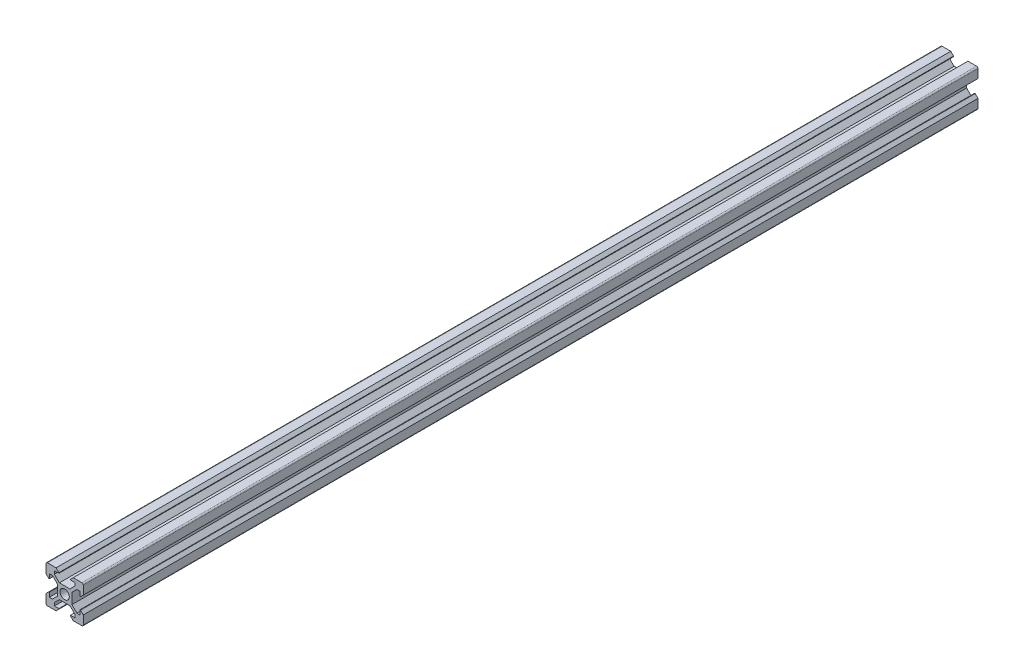
from build123d import *

# Parameters (mm, degrees)
CROQUIS1_R              = 2.5
SALIENTE_EXTRUIR1_DEPTH = 480


with BuildPart() as part:
    # Croquis1 → Saliente-Extruir1 (new body)
    with BuildSketch(Plane.XY):
        with BuildLine():
            Line((-4.6, 10), (-3.1, 8.5))
            Line((-3.1, 8.5), (-3.1, 8.2))
            Line((-3.1, 8.2), (-5.5, 8.2))
            Line((-5.5, 8.2), (-5.5, 6.560660172))
            Line((-5.5, 6.560660172), (-2.84, 3.900660172))
            Line((-2.84, 3.900660172), (0, 3.900660172))
            Line((0, 3.900660172), (2.84, 3.900660172))
            Line((2.84, 3.900660172), (5.5, 6.560660172))
            Line((5.5, 6.560660172), (5.5, 8.2))
            Line((5.5, 8.2), (3.1, 8.2))
            Line((3.1, 8.2), (3.1, 8.5))
            Line((3.1, 8.5), (4.6, 10))
            Line((4.6, 10), (9.25, 10))
            ThreePointArc((9.25, 10), (9.780330086, 9.780330086), (10, 9.25))
            Line((10, 9.25), (10, 4.6))
            Line((10, 4.6), (8.5, 3.1))
            Line((8.5, 3.1), (8.2, 3.1))
            Line((8.2, 3.1), (8.2, 5.5))
            Line((8.2, 5.5), (6.560660172, 5.5))
            Line((6.560660172, 5.5), (3.900660172, 2.84))
            Line((3.900660172, 2.84), (3.900660172, 0))
            Line((3.900660172, 0), (3.900660172, -2.84))
            Line((3.900660172, -2.84), (6.560660172, -5.5))
            Line((6.560660172, -5.5), (8.2, -5.5))
            Line((8.2, -5.5), (8.2, -3.1))
            Line((8.2, -3.1), (8.5, -3.1))
            Line((8.5, -3.1), (10, -4.6))
            Line((10, -4.6), (10, -9.25))
            ThreePointArc((10, -9.25), (9.780330086, -9.780330086), (9.25, -10))
            Line((9.25, -10), (4.6, -10))
            Line((4.6, -10), (3.1, -8.5))
            Line((3.1, -8.5), (3.1, -8.2))
            Line((3.1, -8.2), (5.5, -8.2))
            Line((5.5, -8.2), (5.5, -6.560660172))
            Line((5.5, -6.560660172), (2.84, -3.900660172))
            Line((2.84, -3.900660172), (0, -3.900660172))
            Line((0, -3.900660172), (-2.84, -3.900660172))
            Line((-2.84, -3.900660172), (-5.5, -6.560660172))
            Line((-5.5, -6.560660172), (-5.5, -8.2))
            Line((-5.5, -8.2), (-3.1, -8.2))
            Line((-3.1, -8.2), (-3.1, -8.5))
            Line((-3.1, -8.5), (-4.6, -10))
            Line((-4.6, -10), (-9.25, -10))
            ThreePointArc((-9.25, -10), (-9.780330086, -9.780330086), (-10, -9.25))
            Line((-10, -9.25), (-10, -4.6))
            Line((-10, -4.6), (-8.5, -3.1))
            Line((-8.5, -3.1), (-8.2, -3.1))
            Line((-8.2, -3.1), (-8.2, -5.5))
            Line((-8.2, -5.5), (-6.560660172, -5.5))
            Line((-6.560660172, -5.5), (-3.900660172, -2.84))
            Line((-3.900660172, -2.84), (-3.900660172, 0))
            Line((-3.900660172, 0), (-3.900660172, 2.84))
            Line((-3.900660172, 2.84), (-6.560660172, 5.5))
            Line((-6.560660172, 5.5), (-8.2, 5.5))
            Line((-8.2, 5.5), (-8.2, 3.1))
            Line((-8.2, 3.1), (-8.5, 3.1))
            Line((-8.5, 3.1), (-10, 4.6))
            Line((-10, 4.6), (-10, 9.25))
            ThreePointArc((-10, 9.25), (-9.780330086, 9.780330086), (-9.25, 10))
            Line((-9.25, 10), (-4.6, 10))
        make_face()
        Circle(CROQUIS1_R, mode=Mode.SUBTRACT)
    extrude(amount=SALIENTE_EXTRUIR1_DEPTH)


solid = part.part
